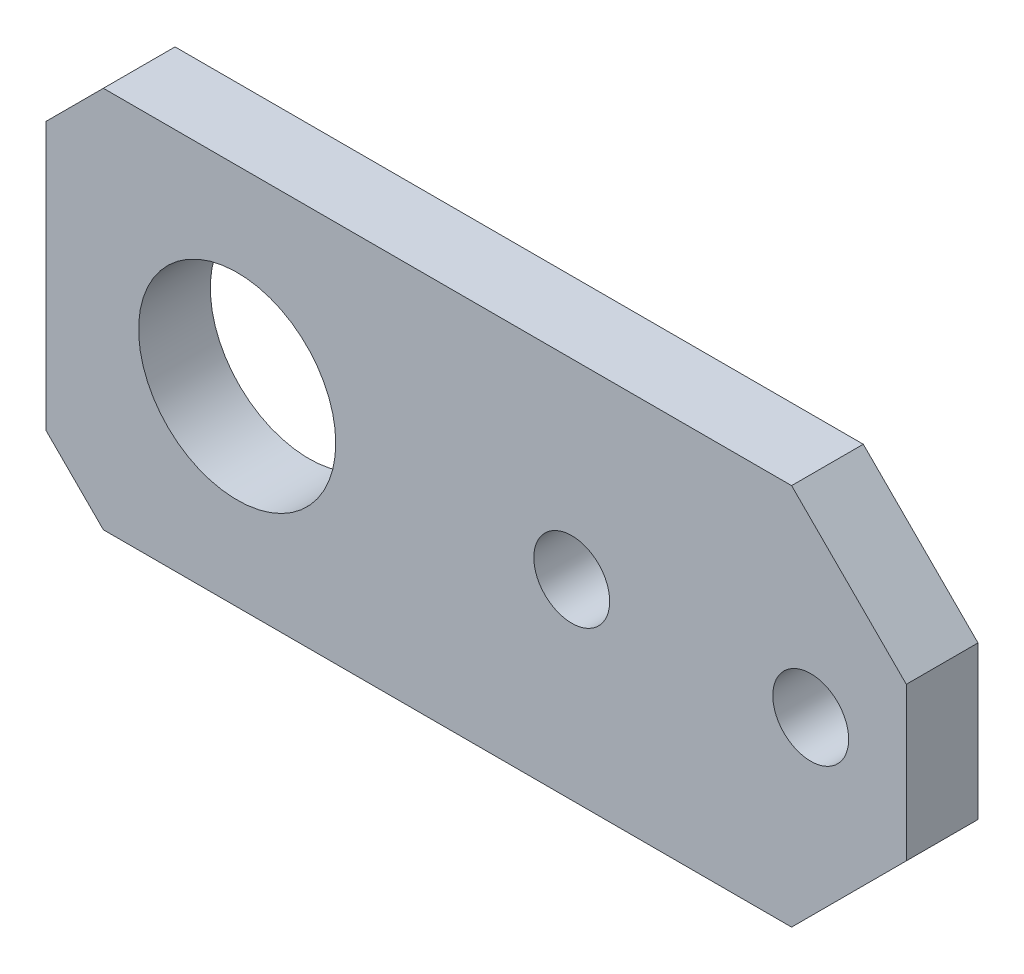
from build123d import *

# Parameters (mm, degrees)
SKETCH1_W               = 114.3
SKETCH1_H               = 50.8
BOSS_EXTRUDE1_DEPTH     = 9.525
F_3_8_CLEARANCE_HOLE1_D = 10.0838
F_1_CLEARANCE_HOLE1_D   = 26.19248
CHAMFER1_SIZE           = 7.62
CHAMFER2_SIZE           = 15.24


with BuildPart() as part:
    # Sketch1 → Boss-Extrude1 (new body)
    with BuildSketch(Plane.XY):
        Rectangle(SKETCH1_W, SKETCH1_H)
    extrude(amount=BOSS_EXTRUDE1_DEPTH)

    # 3/8 Clearance Hole1 (through all)
    with Locations(Plane.XY.offset(9.525)):
        with Locations((44.45, 0), (12.7, 0)):
            Hole(F_3_8_CLEARANCE_HOLE1_D / 2)

    # 1 Clearance Hole1 (through all)
    with Locations(Plane.XY.offset(9.525)):
        with Locations((-31.75, 0)):
            Hole(F_1_CLEARANCE_HOLE1_D / 2)

    # Chamfer1
    chamfer1_edges = [part.edges().sort_by_distance(p)[0] for p in [
        (-57.15, -25.4, 4.7625),
        (-57.15, 25.4, 4.7625),
    ]]
    chamfer(chamfer1_edges, length=CHAMFER1_SIZE)

    # Chamfer2
    chamfer2_edges = [part.edges().sort_by_distance(p)[0] for p in [
        (57.15, -25.4, 4.7625),
        (57.15, 25.4, 4.7625),
    ]]
    chamfer(chamfer2_edges, length=CHAMFER2_SIZE)


solid = part.part
